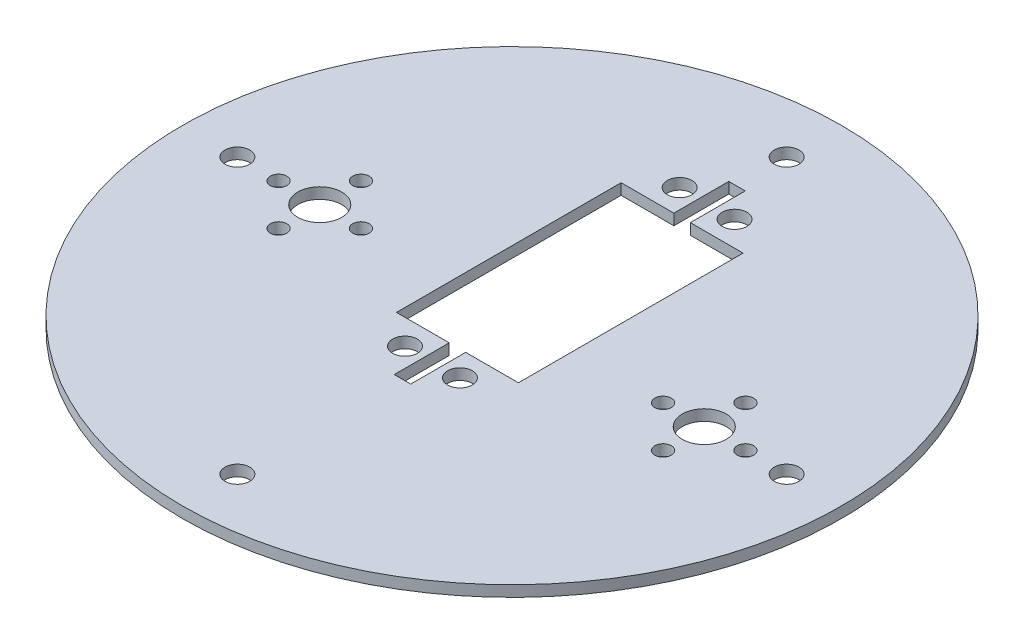
from build123d import *

# Parameters (mm, degrees)
SKETCH1_R               = 60
SKETCH1_R_2             = 2.25
SKETCH1_R_3             = 4
SKETCH1_R_4             = 1.5
SKETCH1_W               = 22.2
SKETCH1_H               = 40.9
BOSS_EXTRUDE1_DEPTH     = 2
SKETCH2_W               = 3
SKETCH2_H               = 10
CUT_EXTRUDE_THIN1_DEPTH = 85.876380696


with BuildPart() as part:
    # Sketch1 → Boss-Extrude1 (new body)
    with BuildSketch(Plane(origin=(0, 0, 0), x_dir=(1, 0, 0), z_dir=(0, 1, 0))):
        with Locations(Location((0, 0, 0), (0, 0, 270))):
            Circle(SKETCH1_R)
        with Locations(Location((0, 50, 0), (0, 0, 270))):
            Circle(SKETCH1_R_2, mode=Mode.SUBTRACT)
        with Locations(Location((50, 0, 0), (0, 0, 270))):
            Circle(SKETCH1_R_2, mode=Mode.SUBTRACT)
        with Locations(Location((0, -50, 0), (0, 0, 270))):
            Circle(SKETCH1_R_2, mode=Mode.SUBTRACT)
        with Locations(Location((-50, 0, 0), (0, 0, 270))):
            Circle(SKETCH1_R_2, mode=Mode.SUBTRACT)
        with Locations(Location((-4.932420963, 35.45, 0), (0, 0, 270))):
            Circle(SKETCH1_R_2, mode=Mode.SUBTRACT)
        with Locations(Location((5.067579037, 35.45, 0), (0, 0, 270))):
            Circle(SKETCH1_R_2, mode=Mode.SUBTRACT)
        with Locations(Location((5.067579037, -14.55, 0), (0, 0, 270))):
            Circle(SKETCH1_R_2, mode=Mode.SUBTRACT)
        with Locations(Location((-4.932420963, -14.55, 0), (0, 0, 270))):
            Circle(SKETCH1_R_2, mode=Mode.SUBTRACT)
        with Locations(Location((-35, 0, 0), (0, 0, 270))):
            Circle(SKETCH1_R_3, mode=Mode.SUBTRACT)
        with Locations(Location((-42.5, 0, 0), (0, 0, 270))):
            Circle(SKETCH1_R_4, mode=Mode.SUBTRACT)
        with Locations(Location((-35, 7.5, 0), (0, 0, 270))):
            Circle(SKETCH1_R_4, mode=Mode.SUBTRACT)
        with Locations(Location((-27.5, 0, 0), (0, 0, 270))):
            Circle(SKETCH1_R_4, mode=Mode.SUBTRACT)
        with Locations(Location((-35, -7.5, 0), (0, 0, 270))):
            Circle(SKETCH1_R_4, mode=Mode.SUBTRACT)
        with Locations(Location((42.5, 0, 0), (0, 0, 270))):
            Circle(SKETCH1_R_4, mode=Mode.SUBTRACT)
        with Locations(Location((35, 0, 0), (0, 0, 270))):
            Circle(SKETCH1_R_3, mode=Mode.SUBTRACT)
        with Locations(Location((35, -7.5, 0), (0, 0, 270))):
            Circle(SKETCH1_R_4, mode=Mode.SUBTRACT)
        with Locations(Location((27.5, 0, 0), (0, 0, 270))):
            Circle(SKETCH1_R_4, mode=Mode.SUBTRACT)
        with Locations(Location((35, 7.5, 0), (0, 0, 270))):
            Circle(SKETCH1_R_4, mode=Mode.SUBTRACT)
        with Locations((0.067579037, 10.45)):
            Rectangle(SKETCH1_W, SKETCH1_H, mode=Mode.SUBTRACT)
    extrude(amount=BOSS_EXTRUDE1_DEPTH)

    # Sketch2 → Cut-Extrude-Thin1 (cut, through all)
    with BuildSketch(Plane.XZ):
        with Locations((0.067579037, 15)):
            Rectangle(SKETCH2_W, SKETCH2_H)
        with Locations((0.067579037, -35.9)):
            Rectangle(SKETCH2_W, SKETCH2_H)
    extrude(amount=-CUT_EXTRUDE_THIN1_DEPTH, mode=Mode.SUBTRACT)


solid = part.part
